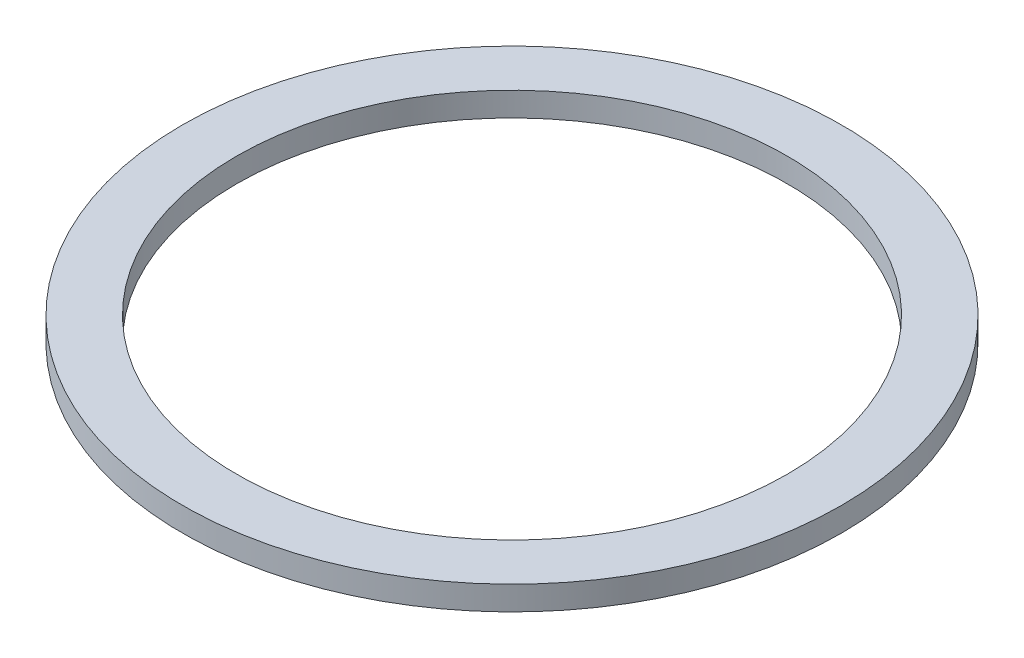
from build123d import *

# Parameters (mm, degrees)
SKETCH1_W = 28.575
SKETCH1_H = 12.7


with BuildPart() as part:
    # Sketch1 → Revolve1 (revolve)
    with BuildSketch(Plane.XY):
        with Locations((159.813733777, 192.433659956)):
            Rectangle(SKETCH1_W, SKETCH1_H)
    revolve(axis=Axis((1e-09, -200000, 0), (0, 1, 0)))


solid = part.part
